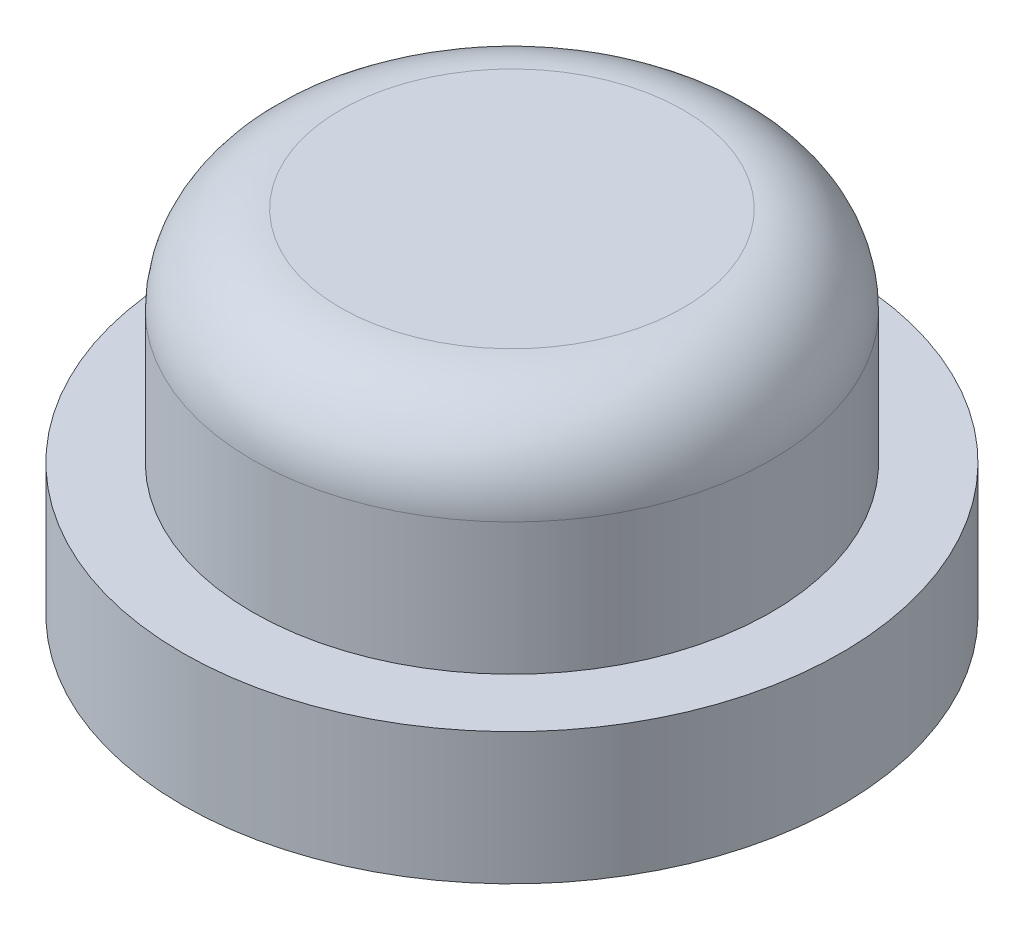
from build123d import *

# Parameters (mm, degrees)
SKETCH_1_R      = 3.75
EXTRUDE_1_DEPTH = 1.5
SKETCH_2_R      = 2.95
EXTRUDE_2_DEPTH = 2.5
FILLET_1_R      = 1


with BuildPart() as part:
    # 草图1 → 凸台-拉伸1 (new body)
    with BuildSketch(Plane(origin=(0, 0, 0), x_dir=(1, 0, 0), z_dir=(0, 1, 0))):
        with Locations(Location((0, 0, 0), (0, 0, 270))):
            Circle(SKETCH_1_R)
    extrude(amount=EXTRUDE_1_DEPTH)

    # 草图2 → 凸台-拉伸2 (add)
    with BuildSketch(Plane(origin=(0, 1.5, 0), x_dir=(1, 0, 0), z_dir=(0, 1, 0))):
        with Locations(Location((0, 0, 0), (0, 0, 270))):
            Circle(SKETCH_2_R)
    extrude(amount=EXTRUDE_2_DEPTH)

    # 圆角1
    fillet_1_edges = [part.edges().sort_by_distance(p)[0] for p in [
        (0, 4, -2.95),
    ]]
    fillet(fillet_1_edges, radius=FILLET_1_R)


solid = part.part
